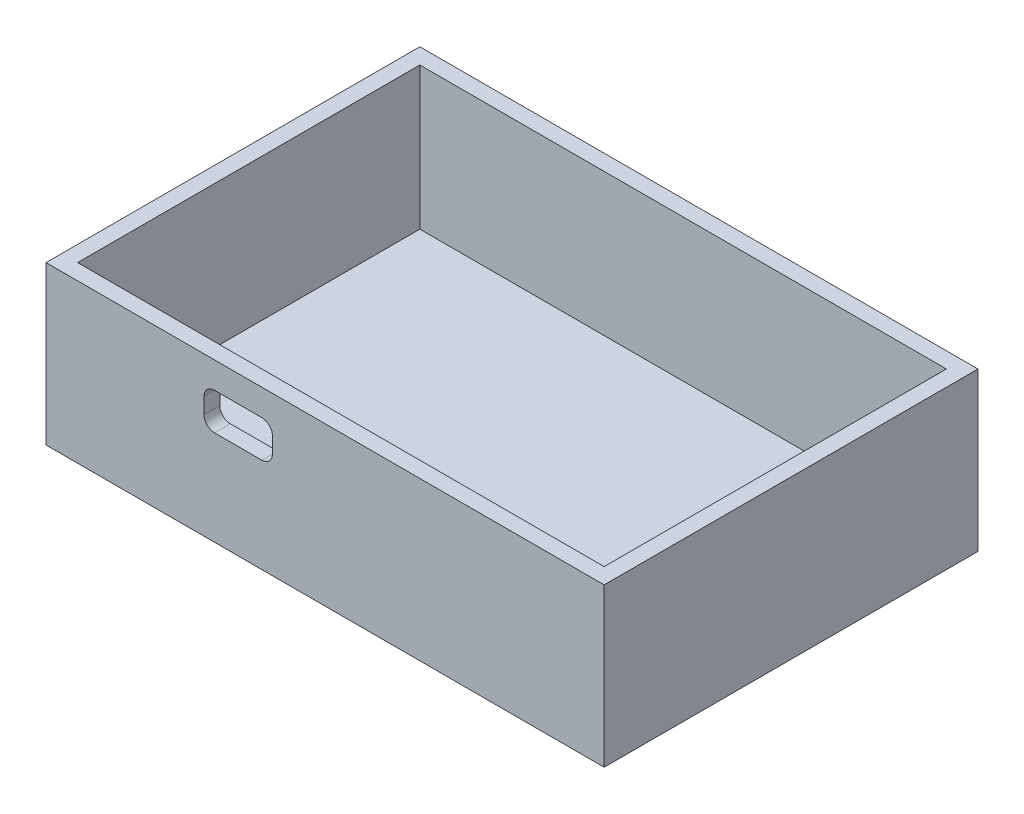
from build123d import *

# Parameters (mm, degrees)
SKETCH1_W           = 106
SKETCH1_H           = 71
BOSS_EXTRUDE1_DEPTH = 30
SKETCH2_W           = 100
SKETCH2_H           = 65
CUT_EXTRUDE1_DEPTH  = 27
SKETCH3_W           = 13
SKETCH3_H           = 7
CUT_EXTRUDE2_DEPTH  = 93.355107755
FILLET1_R           = 2


with BuildPart() as part:
    # Sketch1 → Boss-Extrude1 (new body)
    with BuildSketch(Plane(origin=(0, 0, 0), x_dir=(1, 0, 0), z_dir=(0, 1, 0))):
        with Locations((-1.822129915, 3.859030837)):
            Rectangle(SKETCH1_W, SKETCH1_H)
    extrude(amount=BOSS_EXTRUDE1_DEPTH)

    # Sketch2 → Cut-Extrude1 (cut)
    with BuildSketch(Plane(origin=(0, 30, 0), x_dir=(1, 0, 0), z_dir=(0, 1, 0))):
        with Locations((-1.822129915, 3.859030837)):
            Rectangle(SKETCH2_W, SKETCH2_H)
    extrude(amount=-CUT_EXTRUDE1_DEPTH, mode=Mode.SUBTRACT)

    # Sketch3 → Cut-Extrude2 (cut, through all)
    with BuildSketch(Plane(origin=(0, 0, 28.640969163), x_dir=(-1, 0, 0), z_dir=(0, 0, -1))):
        with Locations((18.322129915, 21.5)):
            Rectangle(SKETCH3_W, SKETCH3_H)
    extrude(amount=-CUT_EXTRUDE2_DEPTH, mode=Mode.SUBTRACT)

    # Fillet1
    fillet1_edges = [part.edges().sort_by_distance(p)[0] for p in [
        (-24.822129915, 25, 30.140969163),
        (-24.822129915, 18, 30.140969163),
        (-11.822129915, 18, 30.140969163),
        (-11.822129915, 25, 30.140969163),
    ]]
    fillet(fillet1_edges, radius=FILLET1_R)


solid = part.part
